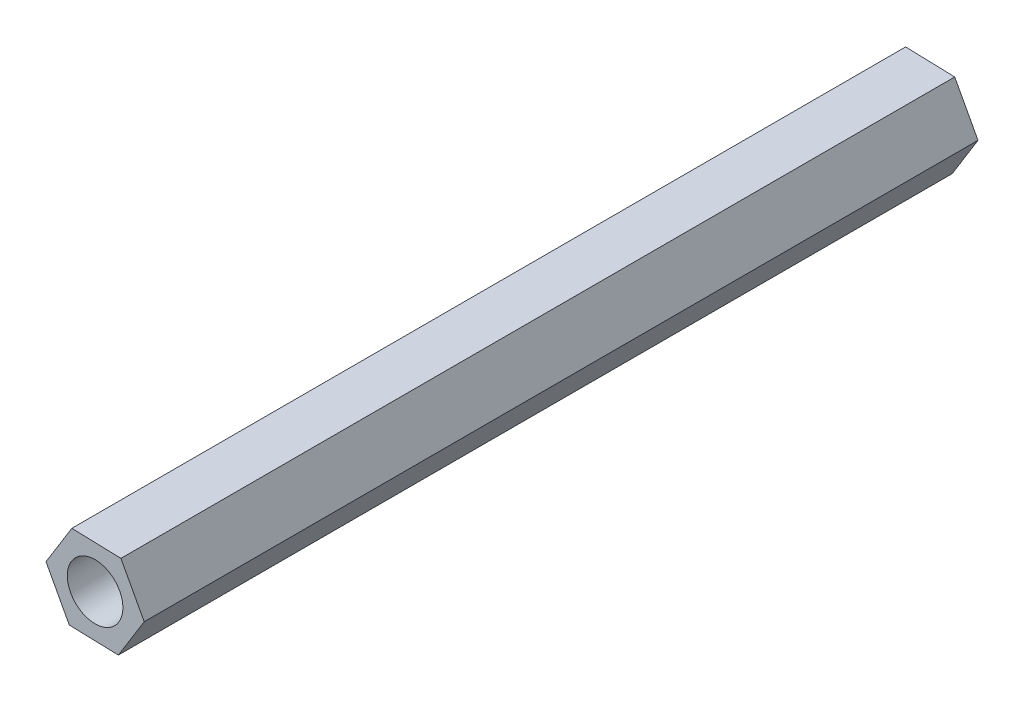
from build123d import *

# Parameters (mm, degrees)
SKETCH1_R           = 1.5
BOSS_EXTRUDE1_DEPTH = 45


with BuildPart() as part:
    # Sketch1 → Boss-Extrude1 (new body)
    with BuildSketch(Plane.XY):
        Polygon((1.255972374, -2.334820439), (2.65, -0.079706237), (1.394027626, 2.255114201), (-1.255972374, 2.334820439), (-2.65, 0.079706237), (-1.394027626, -2.255114201), align=None)
        with Locations(Location((0, 0, 0), (0, 0, 180))):
            Circle(SKETCH1_R, mode=Mode.SUBTRACT)
    extrude(amount=BOSS_EXTRUDE1_DEPTH)


solid = part.part
